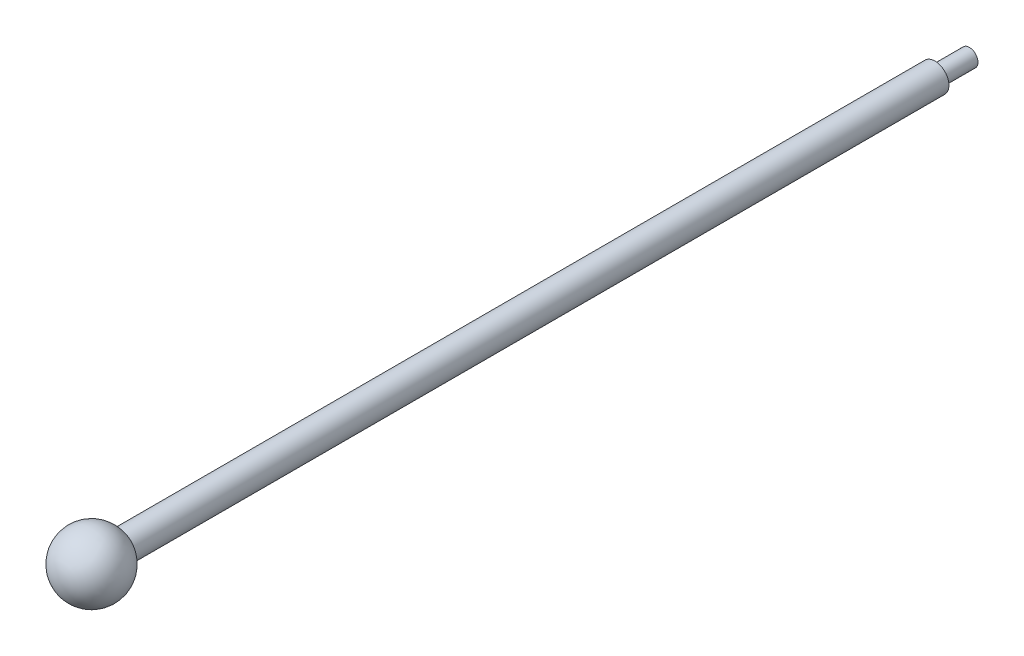
from build123d import *

# Parameters (mm, degrees)
SZKIC2_R                                = 6.5
DODANIE_WYCI_GNI_CIE1_DEPTH             = 376.5
DODANIE_WYCI_GNI_CIE1_DIRECTION_2_REACH = 38.742
SZKIC3_R                                = 4
DODANIE_WYCI_GNI_CIE2_DEPTH             = 16


with BuildPart() as part:
    # Szkic1 → Obrót5 (revolve)
    with BuildSketch(Plane.XY):
        with BuildLine():
            Line((0, 15), (0, -15))
            ThreePointArc((0, -15), (-15, 0), (0, 15))
        make_face()
    revolve(axis=Axis((0, 15, 0), (0, -1, 0)))

    # Szkic2 → Dodanie-wyciągnięcie1 (add)
    with BuildSketch(Plane(origin=(0, 0, -15), x_dir=(-1, 0, 0), z_dir=(0, 0, -1))):
        Circle(SZKIC2_R)
    extrude(amount=DODANIE_WYCI_GNI_CIE1_DEPTH)

    # Szkic2 → Dodanie-wyciągnięcie1 direction 2 (add, up to next)
    with BuildSketch(Plane(origin=(0, 0, -15), x_dir=(-1, 0, 0), z_dir=(0, 0, -1)), mode=Mode.PRIVATE) as dodanie_wyci_gni_cie1_direction_2_sk1:
        Circle(SZKIC2_R)
    dodanie_wyci_gni_cie1_direction_2_tool1 = extrude(dodanie_wyci_gni_cie1_direction_2_sk1.sketch, amount=-DODANIE_WYCI_GNI_CIE1_DIRECTION_2_REACH, mode=Mode.PRIVATE) - part.part
    add(dodanie_wyci_gni_cie1_direction_2_tool1.solids().sort_by_distance((0, 0, -15))[0])

    # Szkic3 → Dodanie-wyciągnięcie2 (add)
    with BuildSketch(Plane(origin=(0, 0, -391.5), x_dir=(-1, 0, 0), z_dir=(0, 0, -1))):
        Circle(SZKIC3_R)
    extrude(amount=DODANIE_WYCI_GNI_CIE2_DEPTH)


solid = part.part
